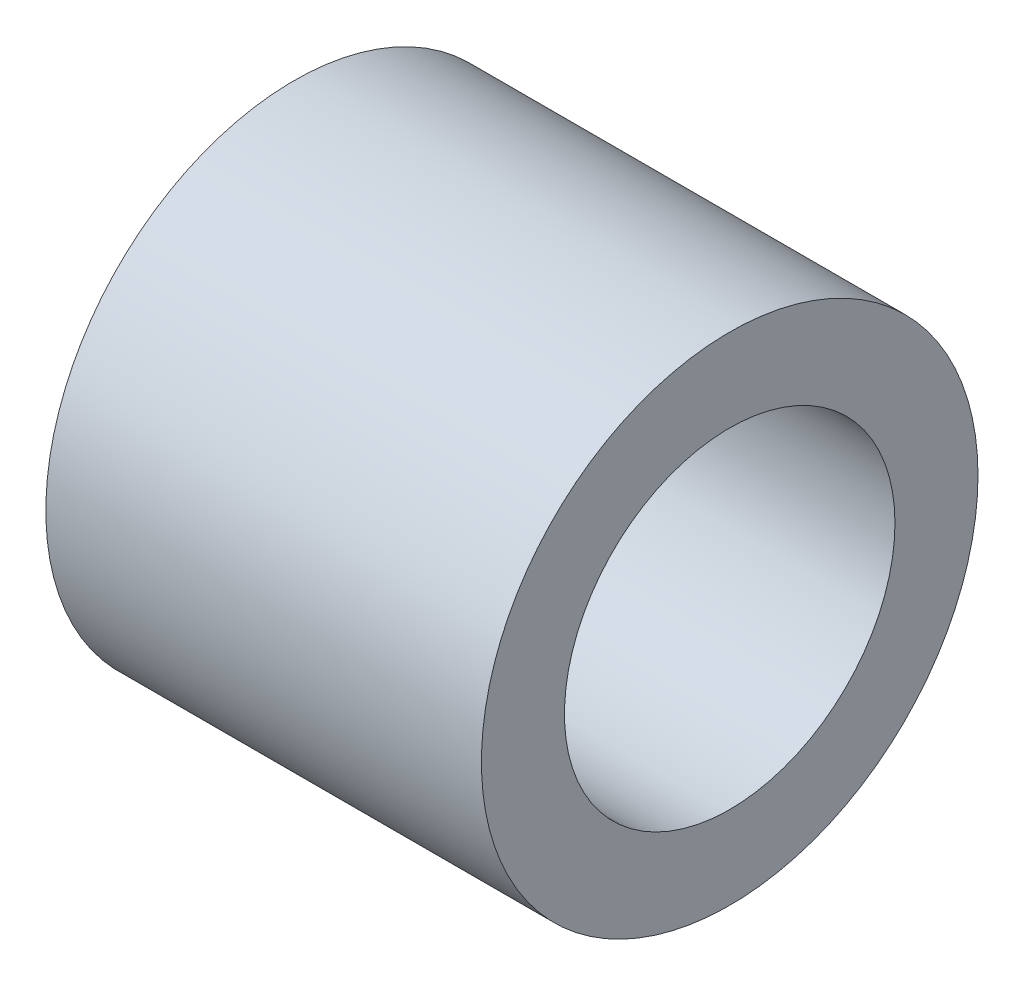
from build123d import *

# Parameters (mm, degrees)
SKETCH1_R           = 3.98145
SKETCH1_R_2         = 2.65
BOSS_EXTRUDE1_DEPTH = 3.4925


with BuildPart() as part:
    # Sketch1 → Boss-Extrude1 (new, symmetric)
    with BuildSketch(Plane(origin=(0, 0, 0), x_dir=(0, 0, -1), z_dir=(1, 0, 0))):
        Circle(SKETCH1_R)
        Circle(SKETCH1_R_2, mode=Mode.SUBTRACT)
    extrude(amount=BOSS_EXTRUDE1_DEPTH, both=True)


solid = part.part
